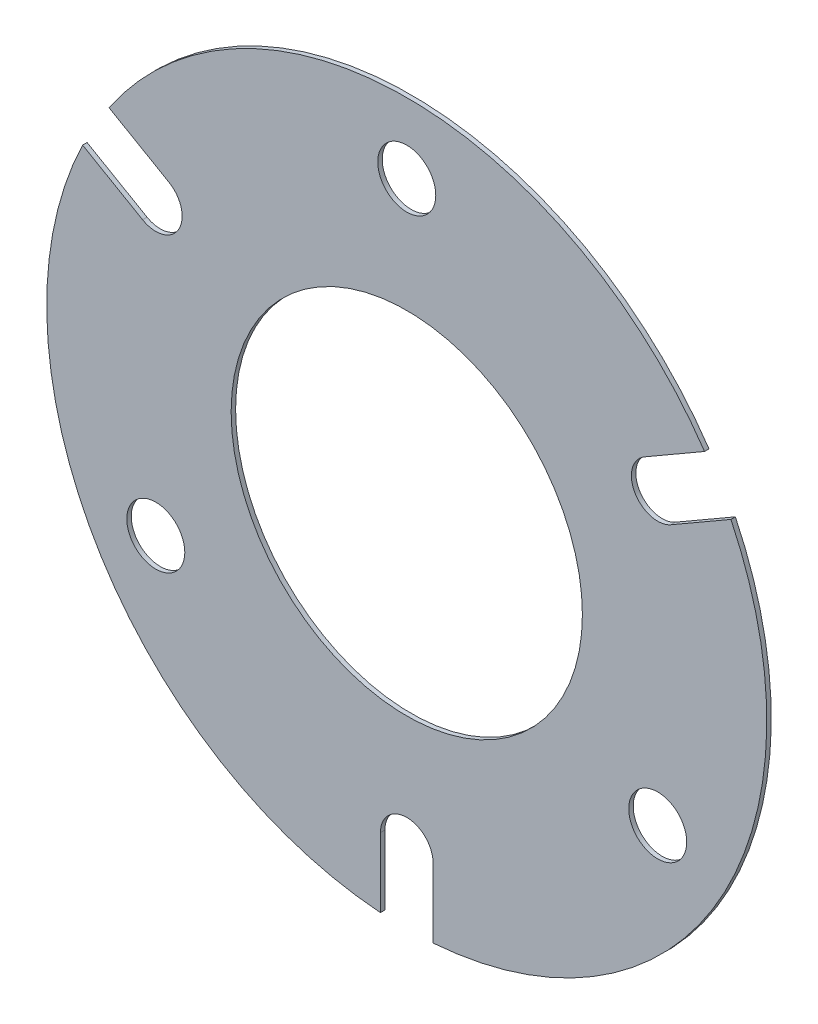
from build123d import *

# Parameters (mm, degrees)
SKETCH1_R          = 20.5
SKETCH1_R_2        = 10
SKETCH1_R_3        = 1.651
EXTRUDE1_DEPTH     = 0.254
CUT_EXTRUDE1_DEPTH = 29.992490683
CIRPATTERN1_COUNT  = 3


with BuildPart() as part:
    # Sketch1 → Extrude1 (new body)
    with BuildSketch(Plane.XY):
        Circle(SKETCH1_R)
        Circle(SKETCH1_R_2, mode=Mode.SUBTRACT)
        with Locations((0, 16.5)):
            Circle(SKETCH1_R_3, mode=Mode.SUBTRACT)
        with Locations((14.289419162, -8.25)):
            Circle(SKETCH1_R_3, mode=Mode.SUBTRACT)
        with Locations((-14.289419162, -8.25)):
            Circle(SKETCH1_R_3, mode=Mode.SUBTRACT)
    extrude(amount=EXTRUDE1_DEPTH)

    # Sketch4 → Cut-Extrude1 (cut, through all)
    with BuildSketch(Plane(origin=(0, 0, 0), x_dir=(-1, 0, 0), z_dir=(0, 0, -1))):
        with BuildLine():
            ThreePointArc((1.5, -16.5), (0, -15), (-1.5, -16.5))
            Line((-1.5, -16.5), (-1.5, -20.4450483))
            ThreePointArc((-1.5, -20.4450483), (0, -20.5), (1.5, -20.4450483))
            Line((1.5, -20.4450483), (1.5, -16.5))
        make_face()
    cut_extrude1 = extrude(amount=-CUT_EXTRUDE1_DEPTH, mode=Mode.SUBTRACT)

    # CirPattern1: Cut-Extrude1 ×3 about axis
    cirpattern1_axis = Axis((0, 0, 0.254), (0, 0, -1))
    for i in range(1, CIRPATTERN1_COUNT):
        add(cut_extrude1.rotate(cirpattern1_axis, i * 360 / CIRPATTERN1_COUNT), mode=Mode.SUBTRACT)


solid = part.part
